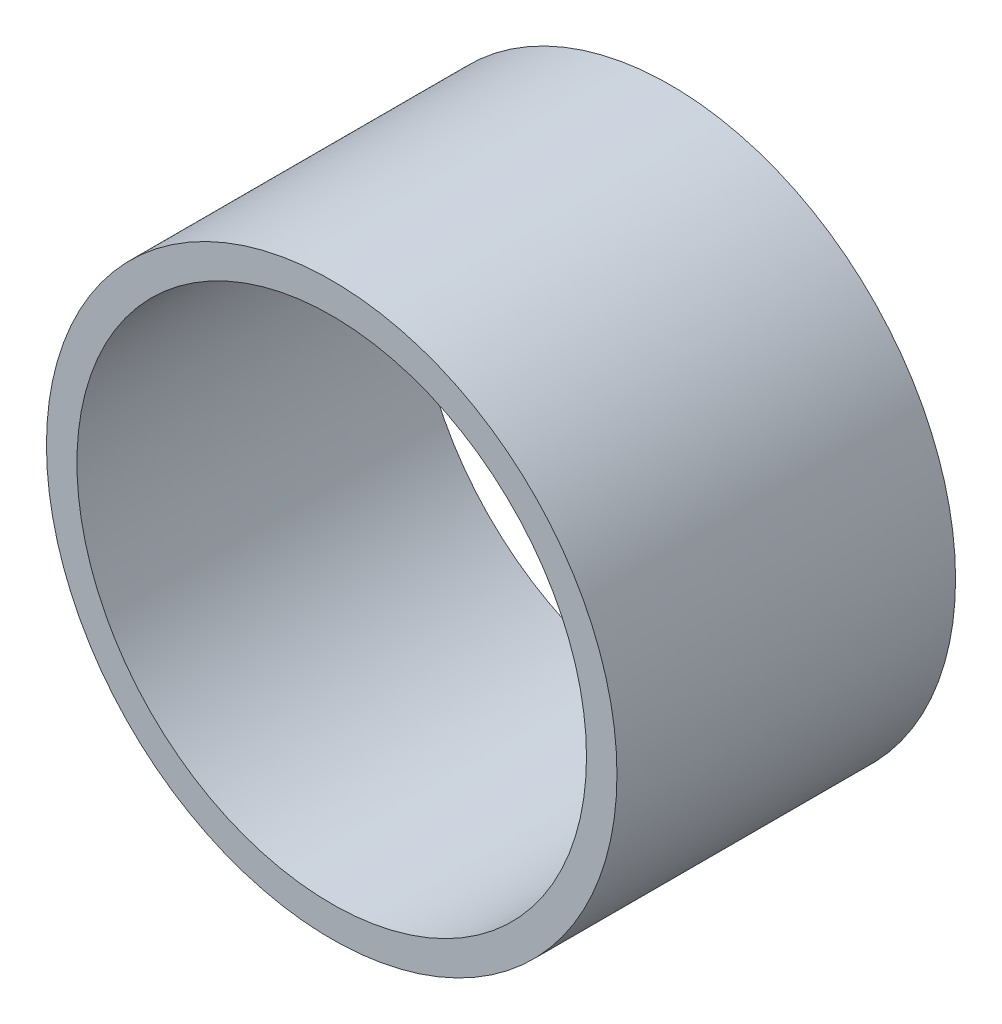
from build123d import *

# Parameters (mm, degrees)
SKETCH1_R           = 17
SKETCH1_R_2         = 15
BOSS_EXTRUDE1_DEPTH = 20
MOVE_FACE1_BY       = 0.15
MOVE_FACE2_BY       = 0.05


with BuildPart() as part:
    # Sketch1 → Boss-Extrude1 (new body)
    with BuildSketch(Plane.XY):
        Circle(SKETCH1_R)
        Circle(SKETCH1_R_2, mode=Mode.SUBTRACT)
    extrude(amount=BOSS_EXTRUDE1_DEPTH)

    # Move Face1: a curved face moved inward by 0.15
    add(Solid.thicken(part.faces().sort_by_distance((-17, 0, 10))[0], -MOVE_FACE1_BY), mode=Mode.SUBTRACT)

    # Move Face2: a curved face moved inward by 0.05
    add(Solid.thicken(part.faces().sort_by_distance((-15, 0, 10))[0], -MOVE_FACE2_BY), mode=Mode.SUBTRACT)


solid = part.part
